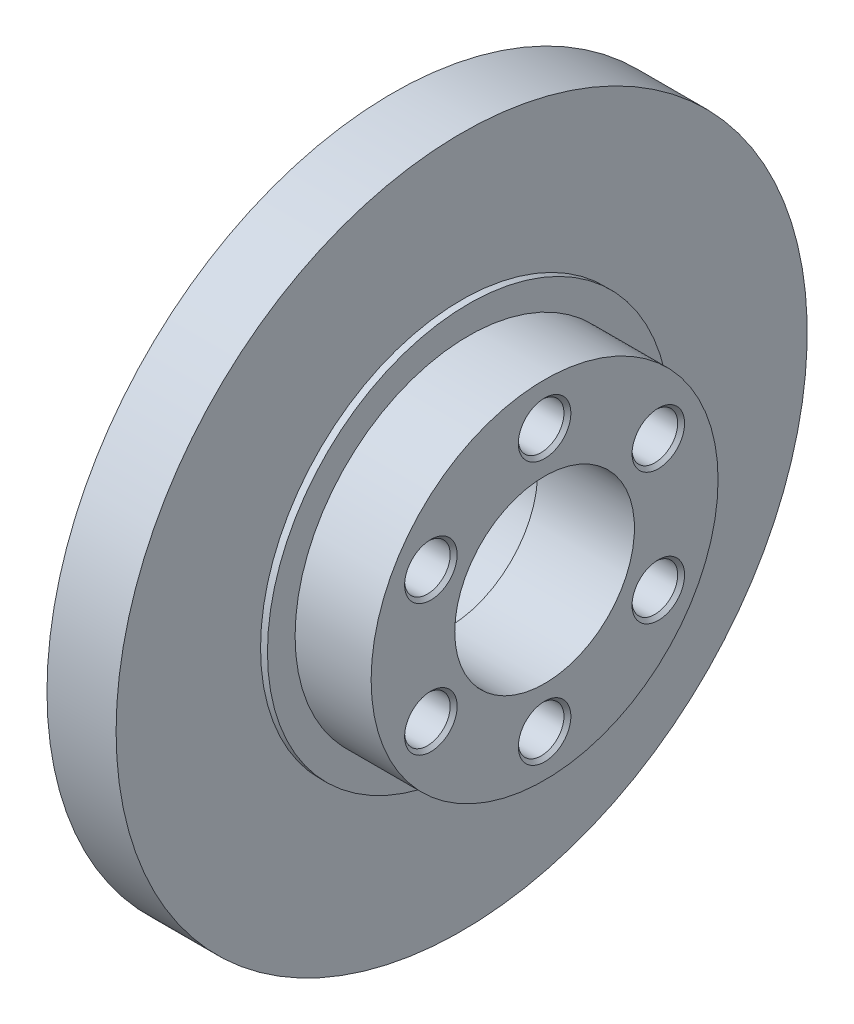
from build123d import *

# Parameters (mm, degrees)
SKETCH3_R          = 2.5
CUT_EXTRUDE1_DEPTH = 4
SKETCH4_R          = 3.3
CUT_EXTRUDE2_DEPTH = 10
CHAMFER1_SIZE      = 0.5


with BuildPart() as part:
    # Sketch2 → Revolve1 (revolve)
    with BuildSketch(Plane.XY, mode=Mode.PRIVATE) as revolve1_sk:
        Polygon((0, 50), (10, 50), (10, 29.1), (11, 29.1), (11, 25.1), (22, 25.1), (22, 13), (8, 13), (8, 14), (0, 14), align=None)
    revolve(revolve1_sk.sketch.rotate(Axis((0, 0, 0), (1, 0, 0)), 90), axis=Axis((0, 0, 0), (1, 0, 0)))

    # Sketch3 → Cut-Extrude1 (cut)
    with BuildSketch(Plane(origin=(0, 0, 0), x_dir=(0, 0, -1), z_dir=(1, 0, 0))):
        with Locations((0, 40)):
            Circle(SKETCH3_R)
        with Locations((28.284271247, 28.284271247)):
            Circle(SKETCH3_R)
        with Locations((40, 0)):
            Circle(SKETCH3_R)
        with Locations((28.284271247, -28.284271247)):
            Circle(SKETCH3_R)
        with Locations((0, -40)):
            Circle(SKETCH3_R)
        with Locations((-28.284271247, -28.284271247)):
            Circle(SKETCH3_R)
        with Locations((-40, 0)):
            Circle(SKETCH3_R)
        with Locations((-28.284271247, 28.284271247)):
            Circle(SKETCH3_R)
    extrude(amount=CUT_EXTRUDE1_DEPTH, mode=Mode.SUBTRACT)

    # Sketch4 → Cut-Extrude2 (cut)
    with BuildSketch(Plane(origin=(22, 0, 0), x_dir=(0, 0, -1), z_dir=(1, 0, 0))):
        with Locations((0, 19)):
            Circle(SKETCH4_R)
        with Locations((16.454482672, 9.5)):
            Circle(SKETCH4_R)
        with Locations((16.454482672, -9.5)):
            Circle(SKETCH4_R)
        with Locations((0, -19)):
            Circle(SKETCH4_R)
        with Locations((-16.454482672, -9.5)):
            Circle(SKETCH4_R)
        with Locations((-16.454482672, 9.5)):
            Circle(SKETCH4_R)
    extrude(amount=-CUT_EXTRUDE2_DEPTH, mode=Mode.SUBTRACT)

    # Chamfer1
    chamfer1_edges = [part.edges().sort_by_distance(p)[0] for p in [
        (22, 19, 3.3),
        (22, 9.5, 19.754482672),
        (22, -9.5, 19.754482672),
        (22, -19, 3.3),
        (22, -9.5, -13.154482672),
        (22, 9.5, -13.154482672),
    ]]
    chamfer(chamfer1_edges, length=CHAMFER1_SIZE)


solid = part.part
